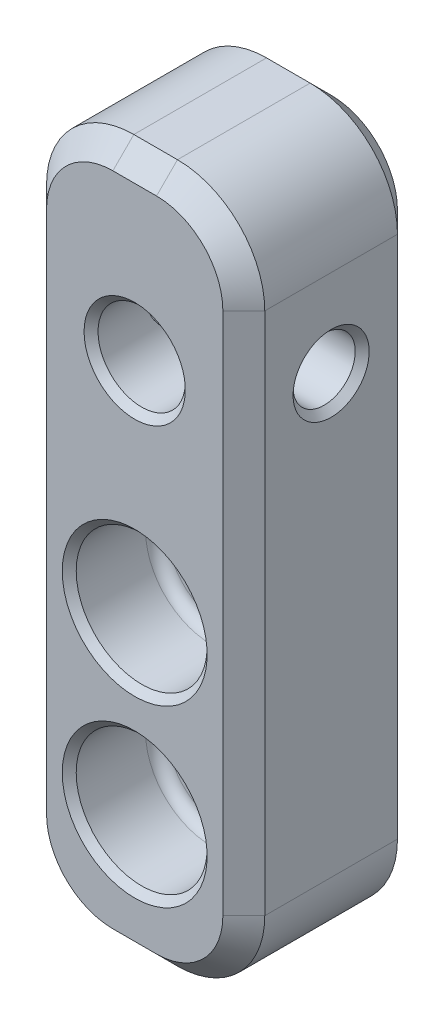
from build123d import *

# Parameters (mm, degrees)
SKETCH1_W                                           = 7.9375
SKETCH1_H                                           = 25.4
BOSS_EXTRUDE1_DEPTH                                 = 3.175
F_1_8_0_125_DIAMETER_HOLE1_D                        = 3.175
CBORE_FOR_2_BINDING_HEAD_MACHINE_SCREW1_D           = 2.4384
CBORE_FOR_2_BINDING_HEAD_MACHINE_SCREW1_CBORE_D     = 4.7625
CBORE_FOR_2_BINDING_HEAD_MACHINE_SCREW1_CBORE_DEPTH = 3.175
F_4_40_TAPPED_HOLE1_D                               = 2.2606
FILLET1_R                                           = 3.175
FILLET2_R                                           = 0.396875
CHAMFER2_SIZE                                       = 0.762
CHAMFER3_SIZE                                       = 0.254


with BuildPart() as part:
    # Sketch1 → Boss-Extrude1 (new, symmetric)
    with BuildSketch(Plane.XY):
        Rectangle(SKETCH1_W, SKETCH1_H)
    extrude(amount=BOSS_EXTRUDE1_DEPTH, both=True)

    # 1/8 (0.125) Diameter Hole1 (through all)
    with Locations(Plane.XY.offset(3.175)):
        with Locations((0, 6.35)):
            Hole(F_1_8_0_125_DIAMETER_HOLE1_D / 2)

    # CBORE for #2 Binding Head Machine Screw1 (through all)
    with Locations(Plane.XY.offset(3.175)):
        with Locations((0, -1.5875), (0, -7.9375)):
            CounterBoreHole(CBORE_FOR_2_BINDING_HEAD_MACHINE_SCREW1_D / 2, CBORE_FOR_2_BINDING_HEAD_MACHINE_SCREW1_CBORE_D / 2, CBORE_FOR_2_BINDING_HEAD_MACHINE_SCREW1_CBORE_DEPTH)

    # #4-40 Tapped Hole1 (through all)
    with Locations(Plane.ZY.offset(3.96875)):
        with Locations((0, 6.35)):
            Hole(F_4_40_TAPPED_HOLE1_D / 2)

    # Fillet1
    fillet1_edges = [part.edges().sort_by_distance(p)[0] for p in [
        (-3.96875, -12.7, 0),
        (3.96875, -12.7, 0),
        (3.96875, 12.7, 0),
        (-3.96875, 12.7, 0),
    ]]
    fillet(fillet1_edges, radius=FILLET1_R)

    # Fillet2
    fillet2_edges = [part.edges().sort_by_distance(p)[0] for p in [
        (-2.38125, -7.9375, 0),
        (-2.38125, -1.5875, 0),
    ]]
    fillet(fillet2_edges, radius=FILLET2_R)

    # Chamfer2
    chamfer2_edges = [part.edges().sort_by_distance(p)[0] for p in [
        (0, 12.7, -3.175),
        (0, 12.7, 3.175),
        (-3.96875, 0, -3.175),
        (3.96875, 0, -3.175),
        (0, -12.7, -3.175),
        (-3.03881403, 11.77006403, -3.175),
        (-3.03881403, -11.77006403, -3.175),
        (3.03881403, -11.77006403, -3.175),
        (3.03881403, 11.77006403, -3.175),
        (3.96875, 0, 3.175),
        (-3.96875, 0, 3.175),
        (0, -12.7, 3.175),
        (-3.03881403, 11.77006403, 3.175),
        (-3.03881403, -11.77006403, 3.175),
        (3.03881403, -11.77006403, 3.175),
        (3.03881403, 11.77006403, 3.175),
    ]]
    chamfer(chamfer2_edges, length=CHAMFER2_SIZE)

    # Chamfer3
    chamfer3_edges = [part.edges().sort_by_distance(p)[0] for p in [
        (1.5875, 6.35, 3.175),
        (1.5875, 6.35, -3.175),
        (-2.38125, -7.9375, 3.175),
        (1.2192, -7.9375, -3.175),
        (1.2192, -7.9375, 0),
        (-2.38125, -1.5875, 3.175),
        (1.2192, -1.5875, -3.175),
        (1.2192, -1.5875, 0),
        (3.96875, 6.35, 1.1303),
        (-3.96875, 6.35, 1.1303),
    ]]
    chamfer(chamfer3_edges, length=CHAMFER3_SIZE)


solid = part.part
